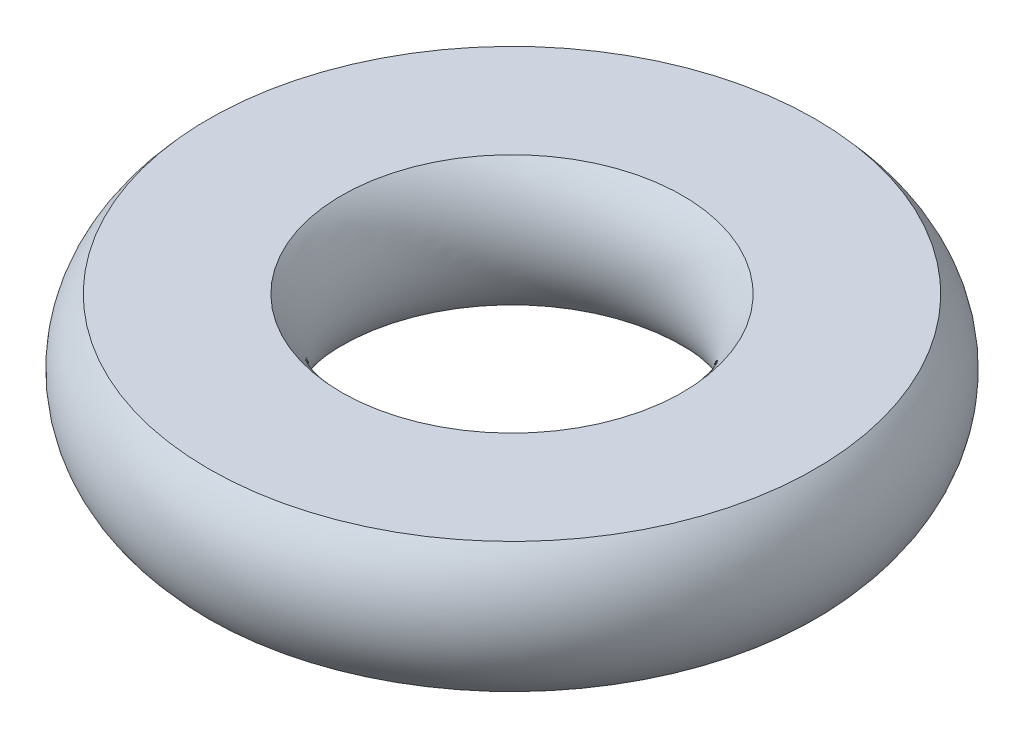
from build123d import *


with BuildPart() as part:
    # Sketch2 → Revolve1 (revolve)
    with BuildSketch(Plane.XY, mode=Mode.PRIVATE) as revolve1_sk:
        with BuildLine():
            Line((1.632071421, 0.35), (0.917928579, 0.35))
            ThreePointArc((0.917928579, 0.35), (0.775, 0), (0.917928579, -0.35))
            Line((0.917928579, -0.35), (1.632071421, -0.35))
            ThreePointArc((1.632071421, -0.35), (1.73789076, -0.189029481), (1.775, 0))
            ThreePointArc((1.775, 0), (1.73789076, 0.189029481), (1.632071421, 0.35))
        make_face()
    revolve(revolve1_sk.sketch.rotate(Axis((0, 0.067477235, 0), (0, -1, 0)), 90), axis=Axis((0, 0.067477235, 0), (0, -1, 0)))


solid = part.part
